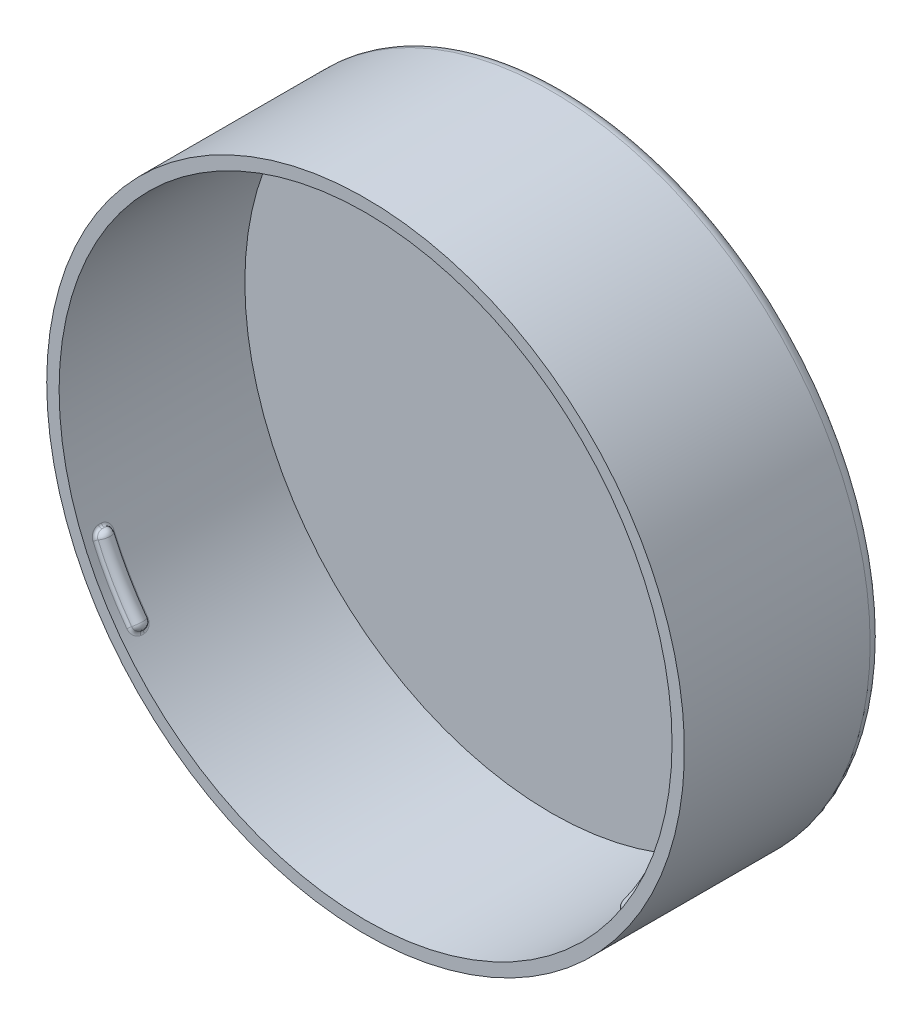
from build123d import *

# Parameters (mm, degrees)
FILLET1_R                 = 2
REVOLVE2_ANGLE            = 15
FILLET9_R                 = 1
FILLET10_R                = 0.5
CIRPATTERN2_COUNT         = 3
FILLET9_OF_CIRPATTERN2_R  = 1
FILLET10_OF_CIRPATTERN2_R = 0.5


with BuildPart() as part:
    # Sketch1 → Revolve1 (revolve)
    with BuildSketch(Plane.YZ, mode=Mode.PRIVATE) as revolve1_sk:
        Polygon((0, 0), (-49.5, 0), (-49.5, 30), (-51.5, 30), (-51.5, -2), (0, -2), align=None)
    revolve(revolve1_sk.sketch.rotate(Axis((0, 0, -2), (0, 0, 1)), 270), axis=Axis((0, 0, -2), (0, 0, 1)))

    # Fillet1
    fillet1_edges = [part.edges().sort_by_distance(p)[0] for p in [
        (51.5, 0, -2),
    ]]
    fillet(fillet1_edges, radius=FILLET1_R)

    # Sketch3 → Revolve2 (revolve, symmetric)
    with BuildSketch(Plane.YZ) as revolve2_sk:
        with BuildLine():
            Line((49.501359894, 28.25), (49.501359894, 25.75))
            ThreePointArc((49.501359894, 25.75), (48.251359894, 27), (49.501359894, 28.25))
        make_face()
    revolve2 = revolve(axis=Axis((0, 0, 30), (0, 0, -1)), revolution_arc=REVOLVE2_ANGLE / 2)
    revolve2 = revolve2 + revolve(revolve2_sk.sketch, axis=Axis((0, 0, 30), (0, 0, 1)), revolution_arc=REVOLVE2_ANGLE / 2)

    # Fillet9
    fillet9_edges = [part.edges().sort_by_distance(p)[0] for p in [
        (-6.298066276, 47.838562821, 27),
        (6.298066276, 47.838562821, 27),
    ]]
    fillet(fillet9_edges, radius=FILLET9_R)

    # Fillet10
    fillet10_edges = [part.edges().sort_by_distance(p)[0] for p in [
        (6.170520321, 49.113894967, 27.957116923),
        (6.170520321, 49.113894967, 26.042883077),
        (6.461046515, 49.076520638, 27),
        (0, 49.5, 28.24999926),
        (0, 49.5, 25.75000074),
        (-6.170520321, 49.113894967, 26.042883076),
        (-6.170520321, 49.113894967, 27.957116924),
        (-6.461046515, 49.076520638, 27),
    ]]
    fillet(fillet10_edges, radius=FILLET10_R)

    # CirPattern2: Revolve2 ×3 about axis
    cirpattern2_axis = Axis((0, 0, 30), (0, 0, -1))
    for i in range(1, CIRPATTERN2_COUNT):
        add(revolve2.rotate(cirpattern2_axis, i * 360 / CIRPATTERN2_COUNT))

    # Fillet9 of CirPattern2
    fillet9_of_cirpattern2_edges = [part.edges().sort_by_distance(p)[0] for p in [
        (44.578443822, -18.46499602, 27),
        (38.280377545, -29.373566801, 27),
        (-38.280377545, -29.373566801, 27),
        (-44.578443822, -18.46499602, 27),
    ]]
    fillet(fillet9_of_cirpattern2_edges, radius=FILLET9_OF_CIRPATTERN2_R)

    # Fillet10 of CirPattern2
    fillet10_of_cirpattern2_edges = [part.edges().sort_by_distance(p)[0] for p in [
        (39.44862056, -29.900774836, 27.957116923),
        (39.44862056, -29.900774836, 26.042883077),
        (39.270990344, -30.133690736, 27),
        (42.868257487, -24.75, 28.24999926),
        (42.868257487, -24.75, 25.75000074),
        (45.619140881, -19.213120131, 26.042883076),
        (45.619140881, -19.213120131, 27.957116924),
        (45.732036859, -18.942829902, 27),
        (-45.619140881, -19.213120131, 27.957116923),
        (-45.619140881, -19.213120131, 26.042883077),
        (-45.732036859, -18.942829902, 27),
        (-42.868257487, -24.75, 28.24999926),
        (-42.868257487, -24.75, 25.75000074),
        (-39.44862056, -29.900774836, 26.042883076),
        (-39.44862056, -29.900774836, 27.957116924),
        (-39.270990344, -30.133690736, 27),
    ]]
    fillet(fillet10_of_cirpattern2_edges, radius=FILLET10_OF_CIRPATTERN2_R)


solid = part.part
